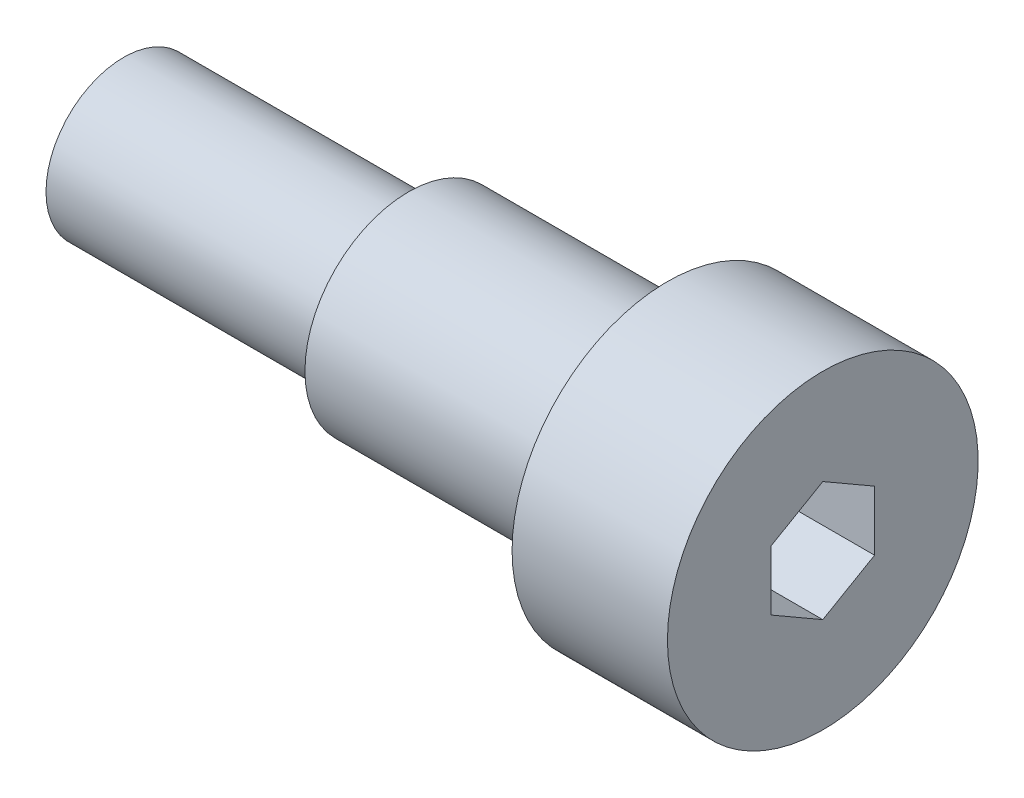
from build123d import *

# Parameters (mm, degrees)
CUT_EXTRUDE1_DEPTH = 4


with BuildPart() as part:
    # Sketch1 → Revolve1 (revolve)
    with BuildSketch(Plane.XY, mode=Mode.PRIVATE) as revolve1_sk:
        Polygon((16, 0), (16, 6), (10, 6), (10, 4), (0, 4), (0, 3), (-11, 3), (-11, 0), align=None)
    revolve(revolve1_sk.sketch.rotate(Axis((0, 0, 0), (1, 0, 0)), 90), axis=Axis((0, 0, 0), (1, 0, 0)))

    # Sketch2 → Cut-Extrude1 (cut)
    with BuildSketch(Plane(origin=(16, 0, 0), x_dir=(0, 0, -1), z_dir=(1, 0, 0))):
        Polygon((0, 2.309401077), (-2, 1.154700538), (-2, -1.154700538), (0, -2.309401077), (2, -1.154700538), (2, 1.154700538), align=None)
    extrude(amount=-CUT_EXTRUDE1_DEPTH, mode=Mode.SUBTRACT)


solid = part.part
